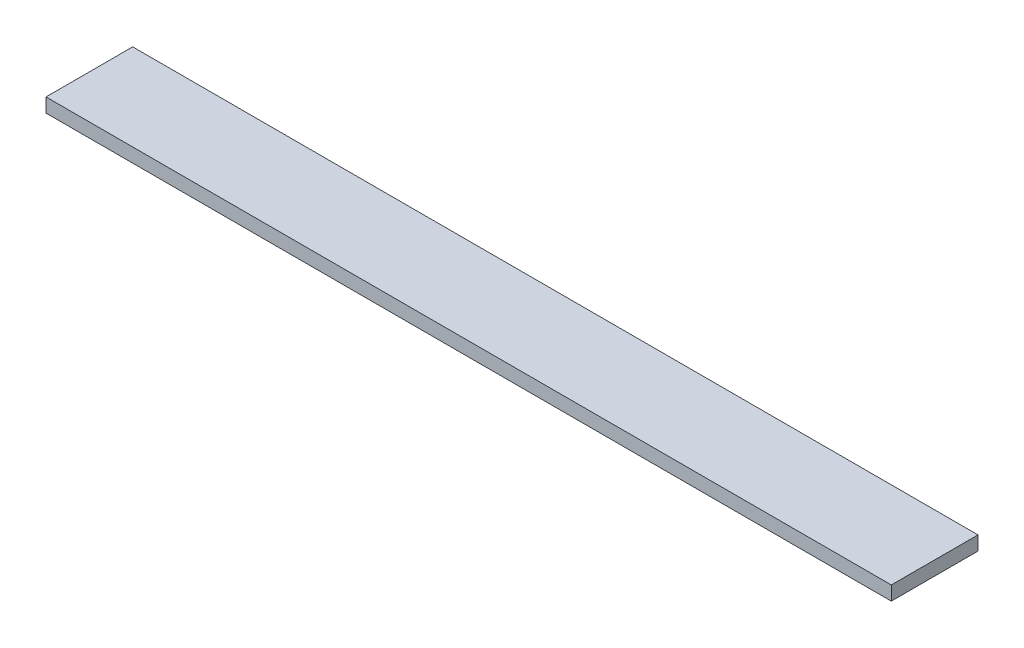
from build123d import *

# Parameters (mm, degrees)
SKETCH1_W           = 1300.1625
SKETCH1_H           = 133.35
BOSS_EXTRUDE1_DEPTH = 21.59


with BuildPart() as part:
    # Sketch1 → Boss-Extrude1 (new body)
    with BuildSketch(Plane(origin=(0, 0, 0), x_dir=(1, 0, 0), z_dir=(0, 1, 0))):
        with Locations((-2489.335518293, 892.591234756)):
            Rectangle(SKETCH1_W, SKETCH1_H)
    extrude(amount=BOSS_EXTRUDE1_DEPTH)


solid = part.part
